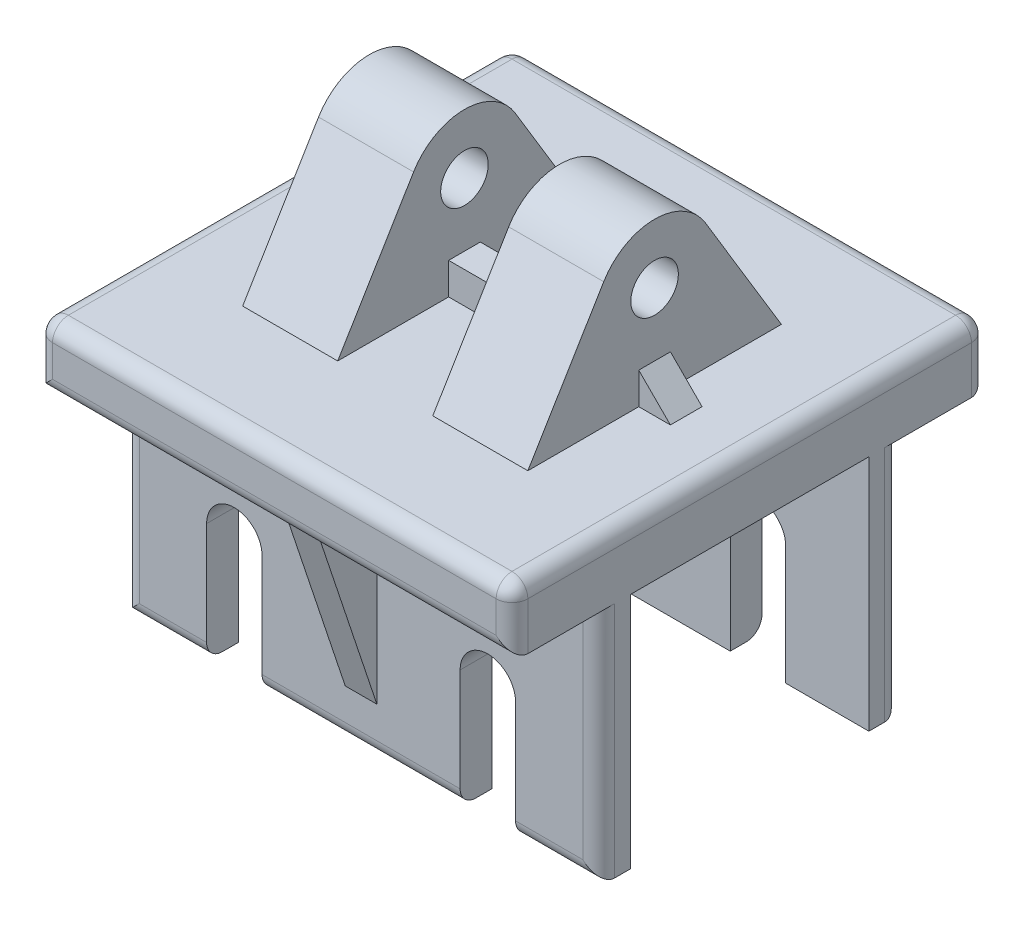
from build123d import *

# Parameters (mm, degrees)
EXTRUDE_1_DEPTH     = 30
EXTRUDE_2_DEPTH     = 2
SKETCH_4_R          = 3
EXTRUDE_3_DEPTH     = 18
CUT_EXTRUDE_1_DEPTH = 6
SKETCH_6_W          = 12
SKETCH_6_H          = 4
EXTRUDE_4_DEPTH     = 2
CUT_EXTRUDE_2_DEPTH = 22
FILLET_1_R          = 2


with BuildPart() as part:
    # 스케치2 → 보스-돌출1 (new, symmetric)
    with BuildSketch(Plane(origin=(0, 0, 0), x_dir=(0, 0, -1), z_dir=(1, 0, 0))):
        Polygon((15.05, 0), (-15.05, 0), (-15.05, -30), (-19.05, -30), (-19.05, 0), (-30, 0), (-30, 8), (30, 8), (30, 0), (19.05, 0), (19.05, -30), (15.05, -30), align=None)
    extrude(amount=EXTRUDE_1_DEPTH, both=True)

    # 스케치3 → 보스-돌출2 (add, symmetric)
    with BuildSketch(Plane(origin=(0, 0, 0), x_dir=(0, 0, -1), z_dir=(1, 0, 0))):
        Polygon((-19.05, 0), (-27.05, 0), (-19.05, -24), align=None)
        Polygon((19.05, 0), (27.05, 0), (19.05, -24), align=None)
    extrude(amount=EXTRUDE_2_DEPTH, both=True)

    # 스케치4 → 보스-돌출3 (add, symmetric)
    with BuildSketch(Plane(origin=(0, 0, 0), x_dir=(0, 0, -1), z_dir=(1, 0, 0))):
        with BuildLine():
            Line((-6.421611649, 23.874648865), (-16, 8))
            Line((-16, 8), (16, 8))
            Line((16, 8), (6.421611649, 23.874648865))
            ThreePointArc((6.421611649, 23.874648865), (0, 27.5), (-6.421611649, 23.874648865))
        make_face()
        with Locations((0, 20)):
            Circle(SKETCH_4_R, mode=Mode.SUBTRACT)
    extrude(amount=EXTRUDE_3_DEPTH, both=True)

    # 스케치5 → 컷-돌출1 (cut, symmetric)
    with BuildSketch(Plane(origin=(0, 0, 0), x_dir=(0, 0, -1), z_dir=(1, 0, 0))):
        with BuildLine():
            Line((-6.421611649, 23.874648865), (-16, 8))
            Line((-16, 8), (16, 8))
            Line((16, 8), (6.421611649, 23.874648865))
            ThreePointArc((6.421611649, 23.874648865), (0, 27.5), (-6.421611649, 23.874648865))
        make_face()
    extrude(amount=CUT_EXTRUDE_1_DEPTH, both=True, mode=Mode.SUBTRACT)

    # 스케치6 → 보스-돌출4 (add, symmetric)
    with BuildSketch(Plane.XY):
        Polygon((-18, 8), (-22, 8), (-18, 12), align=None)
        with Locations((0, 10)):
            Rectangle(SKETCH_6_W, SKETCH_6_H)
        Polygon((17.991556012, 8), (18, 12), (21.991556012, 8), align=None)
    extrude(amount=EXTRUDE_4_DEPTH, both=True)

    # 스케치7 → 컷-돌출2 (cut, symmetric)
    with BuildSketch(Plane.XY):
        with BuildLine():
            Line((-19.5, -15), (-19.5, -30))
            Line((-19.5, -30), (-12.5, -30))
            Line((-12.5, -30), (-12.5, -15))
            ThreePointArc((-12.5, -15), (-16, -11.5), (-19.5, -15))
        make_face()
        with BuildLine():
            Line((12.5, -15), (12.5, -30))
            Line((12.5, -30), (19.5, -30))
            Line((19.5, -30), (19.5, -15))
            ThreePointArc((19.5, -15), (16, -11.5), (12.5, -15))
        make_face()
    extrude(amount=CUT_EXTRUDE_2_DEPTH, both=True, mode=Mode.SUBTRACT)

    # 필렛1
    fillet_1_edges = [part.edges().sort_by_distance(p)[0] for p in [
        (30, -15, -19.05),
        (-30, -15, 19.05),
        (-30, 4, 30),
        (-30, 8, 0),
        (0, -30, 19.05),
        (-24.75, -30, 19.05),
        (-30, 4, -30),
        (0, -30, -19.05),
        (-24.75, -30, -19.05),
        (-30, -15, -19.05),
        (30, 4, -30),
        (30, 8, 0),
        (24.75, -30, 19.05),
        (0, 0, 30),
        (0, 8, 30),
        (0, 8, -30),
        (0, 0, -30),
        (24.75, -30, -19.05),
        (30, 4, 30),
        (30, -15, 19.05),
    ]]
    fillet(fillet_1_edges, radius=FILLET_1_R)


solid = part.part
